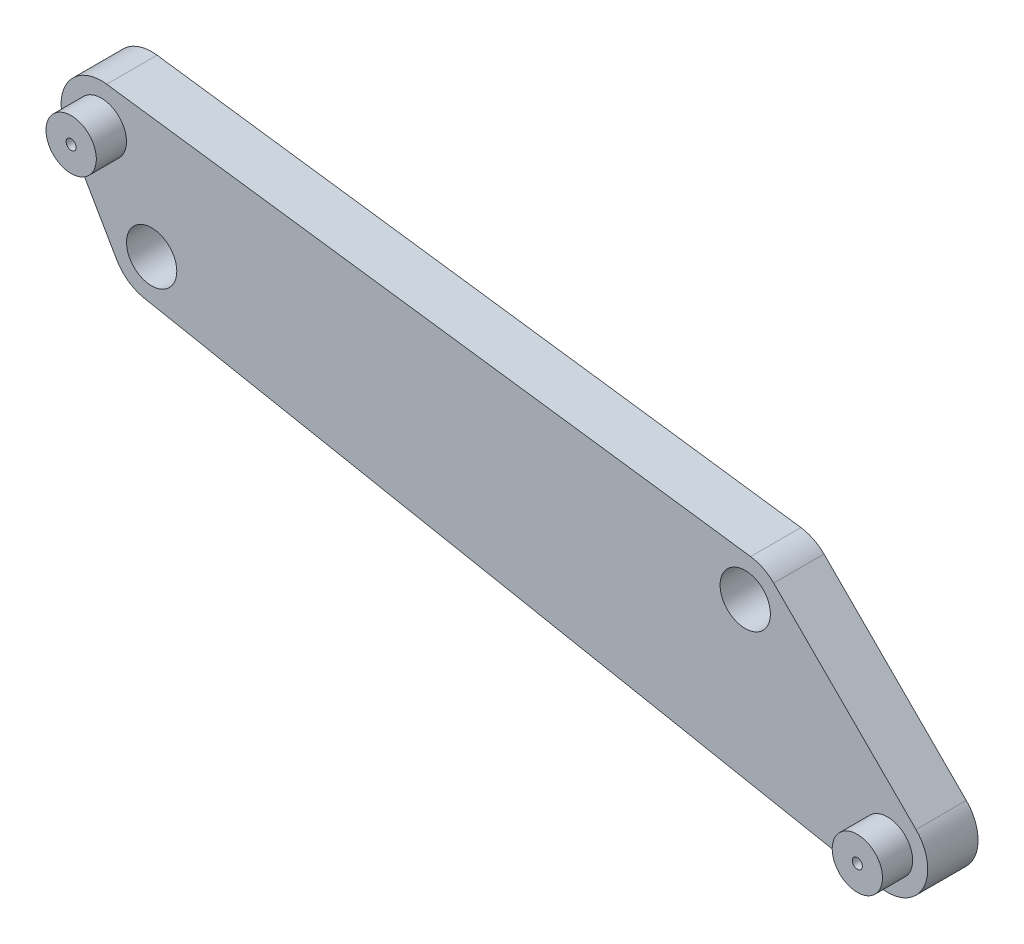
from build123d import *

# Parameters (mm, degrees)
SKETCH2_R           = 2.5
BOSS_EXTRUDE1_DEPTH = 5
SKETCH4_R           = 2.5
SKETCH4_R_2         = 0.5
BOSS_EXTRUDE3_DEPTH = 8


with BuildPart() as part:
    # Sketch2 → Boss-Extrude1 (new body)
    with BuildSketch(Plane.XY):
        with BuildLine():
            Line((-63.463622529, 12.624128305), (0.536377471, 3.963874268))
            ThreePointArc((0.536377471, 3.963874268), (1.775609063, 3.584300832), (2.828427125, 2.828427125))
            Line((2.828427125, 2.828427125), (16.970562748, -11.313708499))
            ThreePointArc((16.970562748, -11.313708499), (17.674856638, -16.018270543), (13.38279363, -18.069399269))
            Line((13.38279363, -18.069399269), (-59.759341994, -3.927263645))
            ThreePointArc((-59.759341994, -3.927263645), (-61.321196947, -3.257613349), (-62.464101615, -2))
            Line((-62.464101615, -2), (-67.464101615, 6.660254038))
            ThreePointArc((-67.464101615, 6.660254038), (-67.321873152, 10.888517659), (-63.463622529, 12.624128305))
        make_face()
        with Locations((-59, 0)):
            Circle(SKETCH2_R, mode=Mode.SUBTRACT)
        with Locations((-64, 8.660254038)):
            Circle(SKETCH2_R, mode=Mode.SUBTRACT)
        Circle(SKETCH2_R, mode=Mode.SUBTRACT)
        with Locations((14.142135624, -14.142135624)):
            Circle(SKETCH2_R, mode=Mode.SUBTRACT)
    extrude(amount=BOSS_EXTRUDE1_DEPTH)

    # Sketch4 → Boss-Extrude3 (add)
    # profile 1 of 2: a face of its own
    with BuildSketch(Plane(origin=(0, 0, 0), x_dir=(-1, 0, 0), z_dir=(0, 0, -1))):
        with Locations((64, 8.660254038)):
            Circle(SKETCH4_R)
        with Locations((64, 8.660254038)):
            Circle(SKETCH4_R_2, mode=Mode.SUBTRACT)
    # profile 2 of 2: a face of its own
    with BuildSketch(Plane(origin=(0, 0, 0), x_dir=(-1, 0, 0), z_dir=(0, 0, -1))):
        with Locations((-14.142135624, -14.142135624)):
            Circle(SKETCH4_R)
        with Locations((-14.142135624, -14.142135624)):
            Circle(SKETCH4_R_2, mode=Mode.SUBTRACT)
    extrude(amount=-BOSS_EXTRUDE3_DEPTH)


solid = part.part
